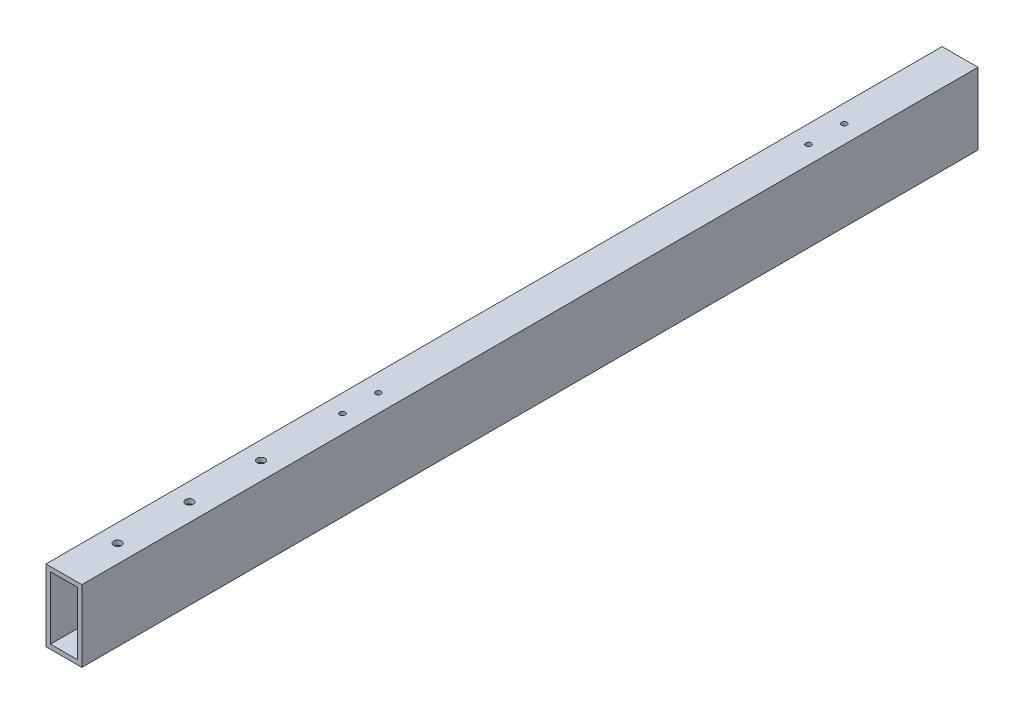
from build123d import *

# Parameters (mm, degrees)
SKETCH1_W           = 25.4
SKETCH1_H           = 50.8
SKETCH1_W_2         = 19.05
SKETCH1_H_2         = 44.45
BOSS_EXTRUDE1_DEPTH = 317.5
SKETCH2_R           = 1.905
CUT_EXTRUDE1_DEPTH  = 322.789030267
SKETCH3_R           = 2.1971
SKETCH3_R_2         = 2.8067
CUT_EXTRUDE2_DEPTH  = 322.789030267


with BuildPart() as part:
    # Sketch1 → Boss-Extrude1 (new, symmetric)
    with BuildSketch(Plane.XY):
        Rectangle(SKETCH1_W, SKETCH1_H)
        Rectangle(SKETCH1_W_2, SKETCH1_H_2, mode=Mode.SUBTRACT)
    extrude(amount=BOSS_EXTRUDE1_DEPTH, both=True)

    # Sketch2 → Cut-Extrude1 (cut, through all)
    with BuildSketch(Plane(origin=(0, 25.4, 0), x_dir=(1, 0, 0), z_dir=(0, 1, 0))):
        with Locations(Location((0, -120.1166, 0), (0, 0, 270))):
            Circle(SKETCH2_R)
        with Locations(Location((0, -94.7166, 0), (0, 0, 270))):
            Circle(SKETCH2_R)
        with Locations(Location((0, 235.48594, 0), (0, 0, 270))):
            Circle(SKETCH2_R)
        with Locations(Location((0, 210.08594, 0), (0, 0, 270))):
            Circle(SKETCH2_R)
    extrude(amount=-CUT_EXTRUDE1_DEPTH, mode=Mode.SUBTRACT)

    # Sketch3 → Cut-Extrude2 (cut, through all)
    with BuildSketch(Plane(origin=(0, 25.4, 0), x_dir=(1, 0, 0), z_dir=(0, 1, 0))):
        with Locations((673.1, -279.399917536)):
            Circle(SKETCH3_R)
        with Locations((673.1, -228.599917536)):
            Circle(SKETCH3_R)
        with Locations((673.1, -177.799917536)):
            Circle(SKETCH3_R)
        with Locations(Location((0, -279.399917536, 0), (0, 0, 270))):
            Circle(SKETCH3_R_2)
        with Locations(Location((0, -228.599917536, 0), (0, 0, 270))):
            Circle(SKETCH3_R_2)
        with Locations(Location((0, -177.799917536, 0), (0, 0, 270))):
            Circle(SKETCH3_R_2)
    extrude(amount=-CUT_EXTRUDE2_DEPTH, mode=Mode.SUBTRACT)


solid = part.part
